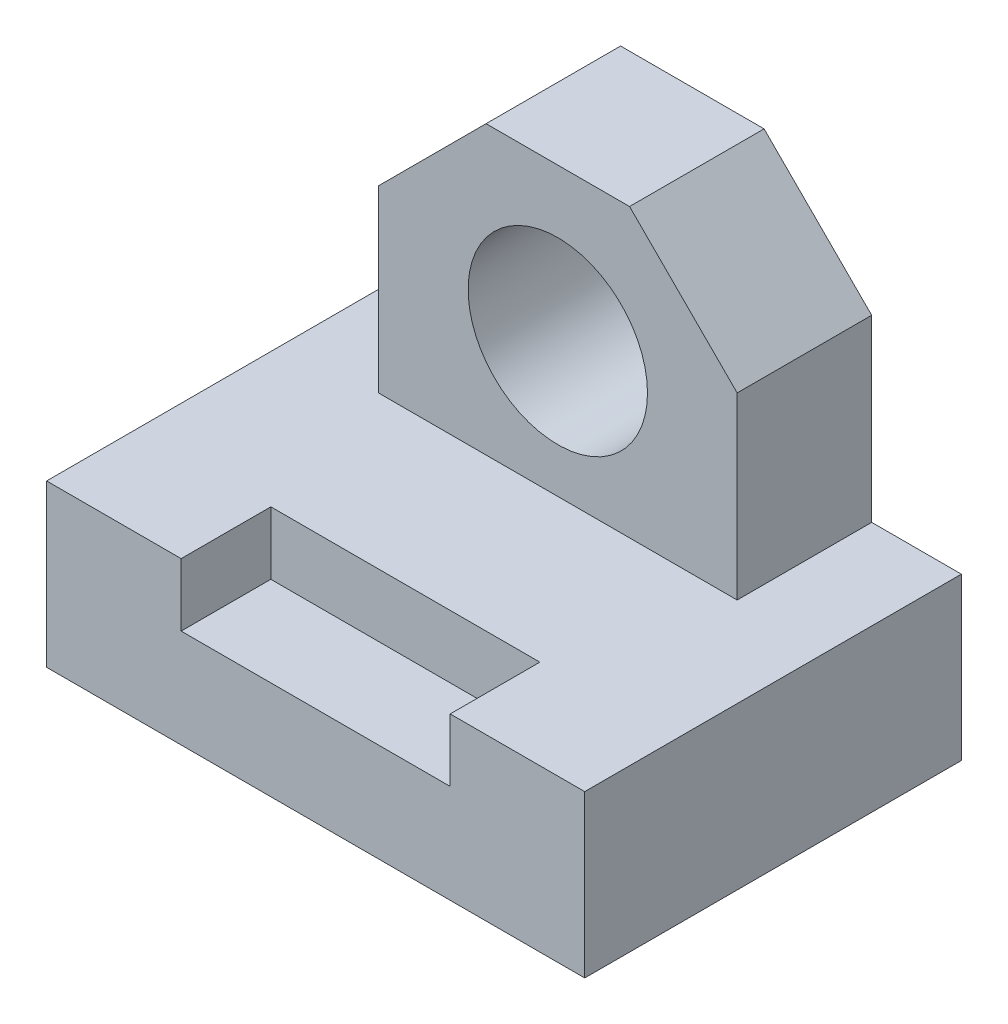
from build123d import *

# Parameters (mm, degrees)
SKETCH1_W           = 60
SKETCH1_H           = 18
BOSS_EXTRUDE1_DEPTH = 42
SKETCH2_W           = 30
SKETCH2_H           = 10
CUT_EXTRUDE1_DEPTH  = 7
BOSS_EXTRUDE2_DEPTH = 15
SKETCH4_R           = 10
CUT_EXTRUDE2_DEPTH  = 65.257295306


with BuildPart() as part:
    # Sketch1 → Boss-Extrude1 (new body)
    with BuildSketch(Plane.XY):
        with Locations((0, 9)):
            Rectangle(SKETCH1_W, SKETCH1_H)
    extrude(amount=BOSS_EXTRUDE1_DEPTH)

    # Sketch2 → Cut-Extrude1 (cut)
    with BuildSketch(Plane(origin=(0, 18, 0), x_dir=(1, 0, 0), z_dir=(0, 1, 0))):
        with Locations((0, -37)):
            Rectangle(SKETCH2_W, SKETCH2_H)
    extrude(amount=-CUT_EXTRUDE1_DEPTH, mode=Mode.SUBTRACT)

    # Sketch3 → Boss-Extrude2 (add)
    with BuildSketch(Plane(origin=(0, 0, 0), x_dir=(-1, 0, 0), z_dir=(0, 0, -1))):
        Polygon((20, 18), (20, 38), (8, 50), (-8, 50), (-20, 38), (-20, 18), align=None)
    extrude(amount=-BOSS_EXTRUDE2_DEPTH)

    # Sketch4 → Cut-Extrude2 (cut, through all)
    with BuildSketch(Plane.XY.offset(15)):
        with Locations((0, 33)):
            Circle(SKETCH4_R)
    extrude(amount=-CUT_EXTRUDE2_DEPTH, mode=Mode.SUBTRACT)


solid = part.part
